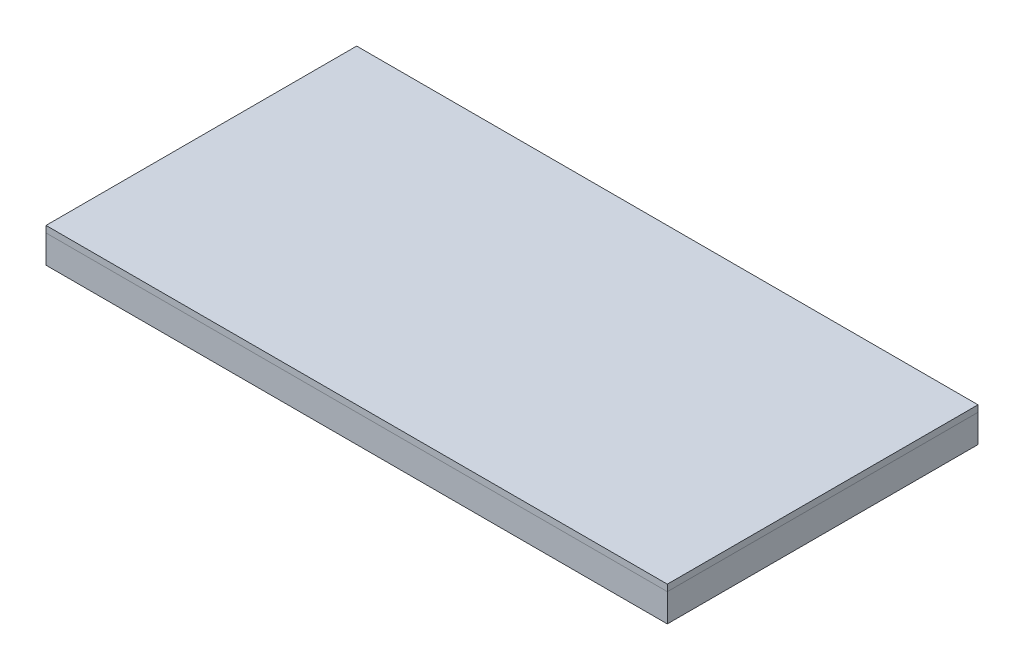
from build123d import *

# Parameters (mm, degrees)
SKIZZE1_W                       = 2000
SKIZZE1_H                       = 1000
AUFSATZ_LINEAR_AUSTRAGEN2_DEPTH = 21
SKIZZE3_W                       = 2000
SKIZZE3_H                       = 1000
SKIZZE3_W_2                     = 1820
SKIZZE3_H_2                     = 820
AUFSATZ_LINEAR_AUSTRAGEN3_DEPTH = 90


with BuildPart() as part:
    # Skizze1 → Aufsatz-Linear austragen2 (new body)
    with BuildSketch(Plane(origin=(0, 0, 0), x_dir=(1, 0, 0), z_dir=(0, 1, 0))):
        Rectangle(SKIZZE1_W, SKIZZE1_H)
    extrude(amount=-AUFSATZ_LINEAR_AUSTRAGEN2_DEPTH)


with BuildPart() as body_2:
    # Skizze3 → Aufsatz-Linear austragen3 (new body)
    with BuildSketch(Plane.XZ.offset(21)):
        Rectangle(SKIZZE3_W, SKIZZE3_H)
        Rectangle(SKIZZE3_W_2, SKIZZE3_H_2, mode=Mode.SUBTRACT)
    extrude(amount=AUFSATZ_LINEAR_AUSTRAGEN3_DEPTH)


solid = Compound([part.part, body_2.part])
